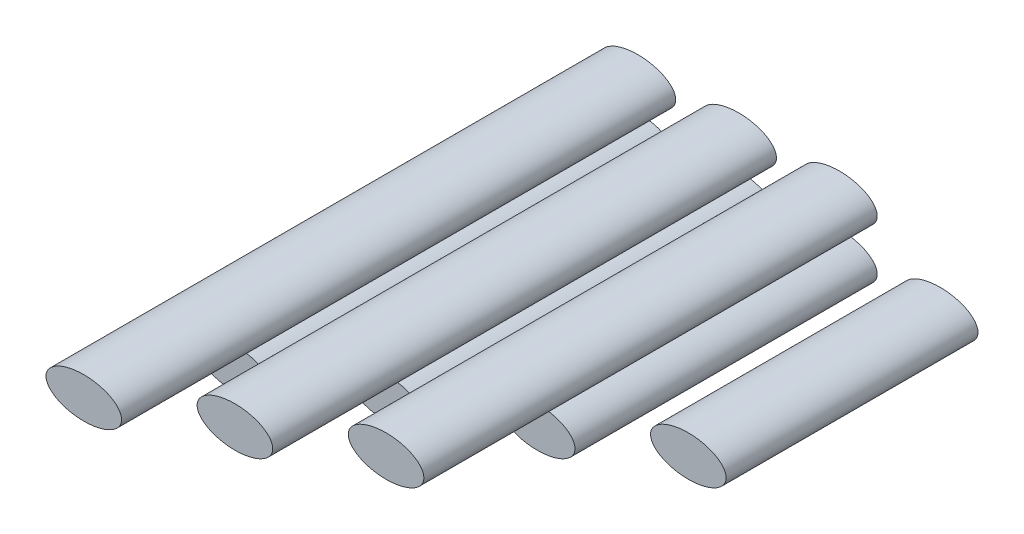
from build123d import *

# Parameters (mm, degrees)
SKETCH2_RX          = 1.5
SKETCH2_RY          = 0.8
BOSS_EXTRUDE1_DEPTH = 10
SKETCH2_3_RX        = 1.5
SKETCH2_3_RY        = 0.8
BOSS_EXTRUDE2_DEPTH = 12
SKETCH2_4_RX        = 1.5
SKETCH2_4_RY        = 0.8
BOSS_EXTRUDE3_DEPTH = 14
SKETCH2_5_RX        = 1.5
SKETCH2_5_RY        = 0.8
BOSS_EXTRUDE4_DEPTH = 16
SKETCH2_6_RX        = 1.5
SKETCH2_6_RY        = 0.8
BOSS_EXTRUDE5_DEPTH = 18
SKETCH2_7_RX        = 1.5
SKETCH2_7_RY        = 0.8
BOSS_EXTRUDE6_DEPTH = 20
SKETCH2_8_RX        = 1.5
SKETCH2_8_RY        = 0.8
BOSS_EXTRUDE7_DEPTH = 22


with BuildPart() as part:
    # Sketch2 → Boss-Extrude1 (new body)
    with BuildSketch(Plane.XY):
        with Locations(Location((12, 0), (0, 0, 180))):
            Ellipse(SKETCH2_RX, SKETCH2_RY)
    extrude(amount=BOSS_EXTRUDE1_DEPTH)


with BuildPart() as body_2:
    # Sketch2<3> → Boss-Extrude2 (new body)
    with BuildSketch(Plane.XY):
        with Locations(Location((8, 0), (0, 0, 180))):
            Ellipse(SKETCH2_3_RX, SKETCH2_3_RY)
    extrude(amount=BOSS_EXTRUDE2_DEPTH)


with BuildPart() as body_3:
    # Sketch2<4> → Boss-Extrude3 (new body)
    with BuildSketch(Plane.XY):
        with Locations(Location((4, 0), (0, 0, 180))):
            Ellipse(SKETCH2_4_RX, SKETCH2_4_RY)
    extrude(amount=BOSS_EXTRUDE3_DEPTH)


with BuildPart() as body_4:
    # Sketch2<5> → Boss-Extrude4 (new body)
    with BuildSketch(Plane.XY):
        with Locations(Location((0, 0), (0, 0, 180))):
            Ellipse(SKETCH2_5_RX, SKETCH2_5_RY)
    extrude(amount=BOSS_EXTRUDE4_DEPTH)


with BuildPart() as body_5:
    # Sketch2<6> → Boss-Extrude5 (new body)
    with BuildSketch(Plane.XY):
        with Locations(Location((8, 2), (0, 0, 180))):
            Ellipse(SKETCH2_6_RX, SKETCH2_6_RY)
    extrude(amount=BOSS_EXTRUDE5_DEPTH)


with BuildPart() as body_6:
    # Sketch2<7> → Boss-Extrude6 (new body)
    with BuildSketch(Plane.XY):
        with Locations(Location((4, 2), (0, 0, 180))):
            Ellipse(SKETCH2_7_RX, SKETCH2_7_RY)
    extrude(amount=BOSS_EXTRUDE6_DEPTH)


with BuildPart() as body_7:
    # Sketch2<8> → Boss-Extrude7 (new body)
    with BuildSketch(Plane.XY):
        with Locations(Location((0, 2), (0, 0, 180))):
            Ellipse(SKETCH2_8_RX, SKETCH2_8_RY)
    extrude(amount=BOSS_EXTRUDE7_DEPTH)


solid = Compound([part.part, body_2.part, body_3.part, body_4.part, body_5.part, body_6.part, body_7.part])
